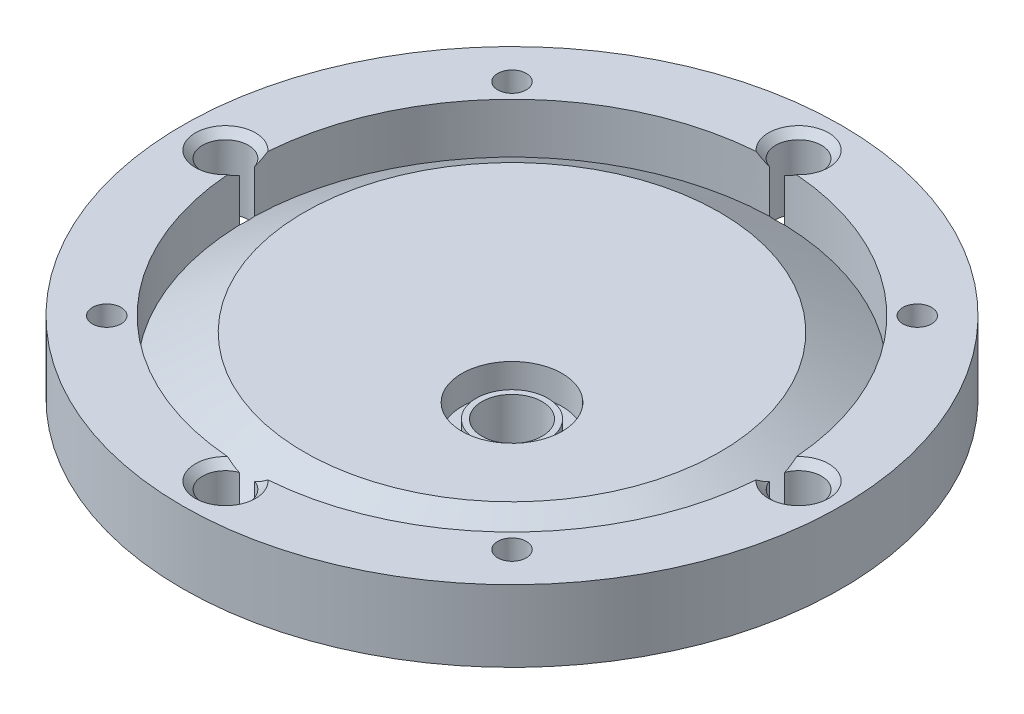
from build123d import *

# Parameters (mm, degrees)
SKETCH_1_R            = 23
EXTRUDE_1_DEPTH       = 5
SKETCH_2_R            = 1.6
CUT_EXTRUDE_1_DEPTH   = 33.908965344
SKETCH_3_R            = 1
CUT_EXTRUDE_2_DEPTH   = 33.908965344
SKETCH_4_W            = 14.5
SKETCH_4_H            = 1
SKETCH_5_R            = 2.1
CUT_EXTRUDE_3_DEPTH   = 33.771939229
SKETCH_6_R            = 3.5
SKETCH_6_R_2          = 2.5
CUT_EXTRUDE_1_2_DEPTH = 2
SKETCH_7_R            = 3.5
CUT_EXTRUDE_4_DEPTH   = 1
CHAMFER_1_SIZE        = 0.5


with BuildPart() as part:
    # 草图1 → 凸台-拉伸1 (new body)
    with BuildSketch(Plane(origin=(0, 0, 0), x_dir=(1, 0, 0), z_dir=(0, 1, 0))):
        with Locations(Location((0, 0, 0), (0, 0, 270))):
            Circle(SKETCH_1_R)
    extrude(amount=EXTRUDE_1_DEPTH)

    # 草图2 → Cut-Extrude 1 (cut, through all)
    with BuildSketch(Plane(origin=(0, 5, 0), x_dir=(1, 0, 0), z_dir=(0, 1, 0))):
        with Locations(Location((0, 20, 0), (0, 0, 270))):
            Circle(SKETCH_2_R)
        with Locations(Location((20.001, 0.001, 0), (0, 0, 270))):
            Circle(SKETCH_2_R)
        with Locations(Location((0.002, -20, 0), (0, 0, 270))):
            Circle(SKETCH_2_R)
        with Locations(Location((-19.999, -0.001, 0), (0, 0, 270))):
            Circle(SKETCH_2_R)
    extrude(amount=-CUT_EXTRUDE_1_DEPTH, mode=Mode.SUBTRACT)

    # 草图3 → 切除-拉伸2 (cut, through all)
    with BuildSketch(Plane(origin=(0, 5, 0), x_dir=(1, 0, 0), z_dir=(0, 1, 0))):
        with Locations(Location((14.142135624, 14.142135624, 0), (0, 0, 270))):
            Circle(SKETCH_3_R)
        with Locations(Location((14.142135624, -14.142135624, 0), (0, 0, 270))):
            Circle(SKETCH_3_R)
        with Locations(Location((-14.142135624, -14.142135624, 0), (0, 0, 270))):
            Circle(SKETCH_3_R)
        with Locations(Location((-14.142135624, 14.142135624, 0), (0, 0, 270))):
            Circle(SKETCH_3_R)
    extrude(amount=-CUT_EXTRUDE_2_DEPTH, mode=Mode.SUBTRACT)

    # 草图4 → 切除-旋转1 (revolve, cut)
    with BuildSketch(Plane.XY, mode=Mode.PRIVATE) as cut_revolve_1_sk:
        with Locations((7.25, 4.5)):
            Rectangle(SKETCH_4_W, SKETCH_4_H)
        Polygon((18.5, 1.5), (18.5, 5), (14.5, 5), (14.5, 4), align=None)
    revolve(cut_revolve_1_sk.sketch.rotate(Axis((0, 0, 0), (0, 1, 0)), 90), axis=Axis((0, 0, 0), (0, 1, 0)), mode=Mode.SUBTRACT)

    # 草图5 → 切除-拉伸3 (cut, through all)
    with BuildSketch(Plane(origin=(0, 4, 0), x_dir=(1, 0, 0), z_dir=(0, 1, 0))):
        with Locations(Location((4.242640687, -4.242640687, 0), (0, 0, 270))):
            Circle(SKETCH_5_R)
    extrude(amount=-CUT_EXTRUDE_3_DEPTH, mode=Mode.SUBTRACT)

    # 草图6 → Cut-Extrude 1 2 (cut)
    with BuildSketch(Plane(origin=(0, 4, 0), x_dir=(1, 0, 0), z_dir=(0, 1, 0))):
        with Locations((4.242640687, -4.242640687)):
            Circle(SKETCH_6_R)
        with Locations((4.242640687, -4.242640687)):
            Circle(SKETCH_6_R_2, mode=Mode.SUBTRACT)
    extrude(amount=-CUT_EXTRUDE_1_2_DEPTH, mode=Mode.SUBTRACT)

    # 草图7 → 切除-拉伸4 (cut)
    with BuildSketch(Plane(origin=(0, 4, 0), x_dir=(1, 0, 0), z_dir=(0, 1, 0))):
        with Locations((4.242640687, -4.242640687)):
            Circle(SKETCH_7_R)
    extrude(amount=-CUT_EXTRUDE_4_DEPTH, mode=Mode.SUBTRACT)

    # 倒角1
    chamfer_1_edges = [part.edges().sort_by_distance(p)[0] for p in [
        (0, 5, -21.6),
        (21.307215325, 5, -0.925013812),
        (1.578782453, 5, 20.271582579),
        (-21.306855112, 5, -0.920691384),
    ]]
    chamfer(chamfer_1_edges, length=CHAMFER_1_SIZE)


solid = part.part
